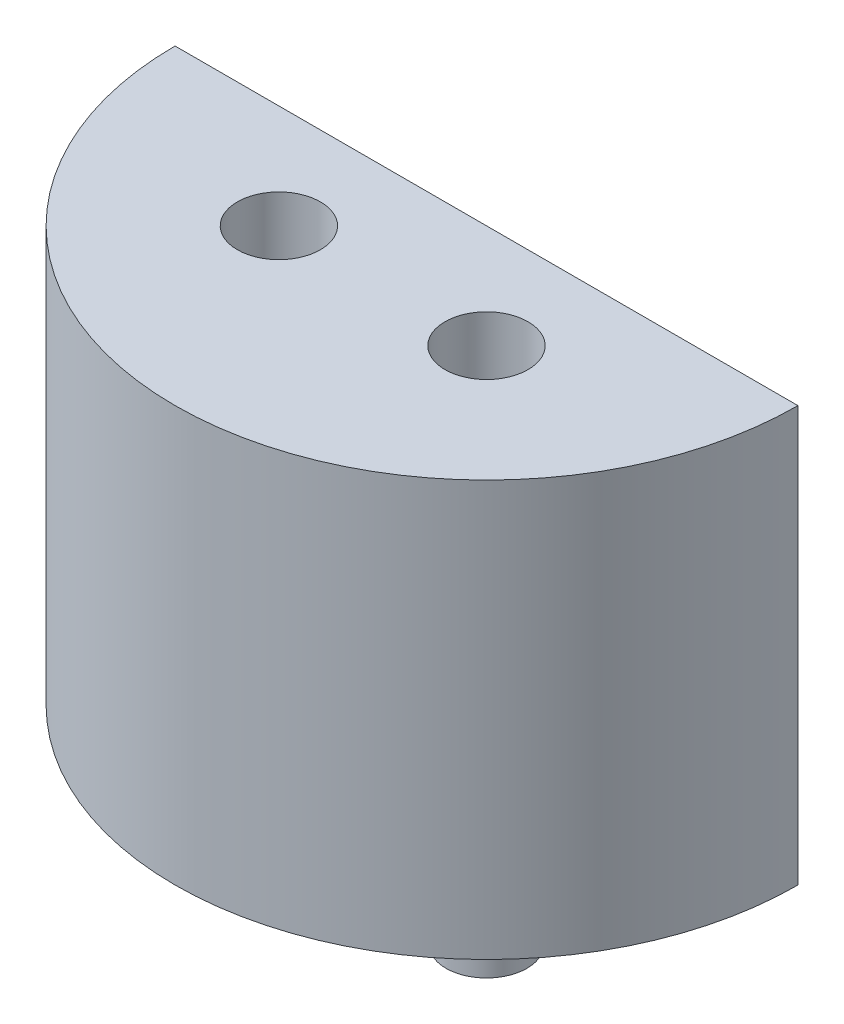
from build123d import *

# Parameters (mm, degrees)
EXTRUDE_1_DEPTH     = 20
SKETCH_2_R          = 2
CUT_EXTRUDE_1_DEPTH = 6
SKETCH_3_R          = 1.95
EXTRUDE_2_DEPTH     = 5


with BuildPart() as part:
    # 草图1 → 凸台-拉伸1 (new body)
    with BuildSketch(Plane(origin=(0, 0, 0), x_dir=(1, 0, 0), z_dir=(0, 1, 0))):
        with BuildLine():
            Line((-15, 0), (15, 0))
            ThreePointArc((15, 0), (0, -15), (-15, 0))
        make_face()
    extrude(amount=EXTRUDE_1_DEPTH)

    # 草图2 → 切除-拉伸1 (cut)
    with BuildSketch(Plane(origin=(0, 20, 0), x_dir=(1, 0, 0), z_dir=(0, 1, 0))):
        with Locations(Location((-5, -5, 0), (0, 0, 270))):
            Circle(SKETCH_2_R)
        with Locations(Location((5, -5, 0), (0, 0, 90))):
            Circle(SKETCH_2_R)
    extrude(amount=-CUT_EXTRUDE_1_DEPTH, mode=Mode.SUBTRACT)

    # 草图3 → 凸台-拉伸2 (add)
    with BuildSketch(Plane.XZ):
        with Locations(Location((5, 5, 0), (0, 0, 90))):
            Circle(SKETCH_3_R)
        with Locations(Location((-5, 5, 0), (0, 0, 90))):
            Circle(SKETCH_3_R)
    extrude(amount=EXTRUDE_2_DEPTH)


solid = part.part
